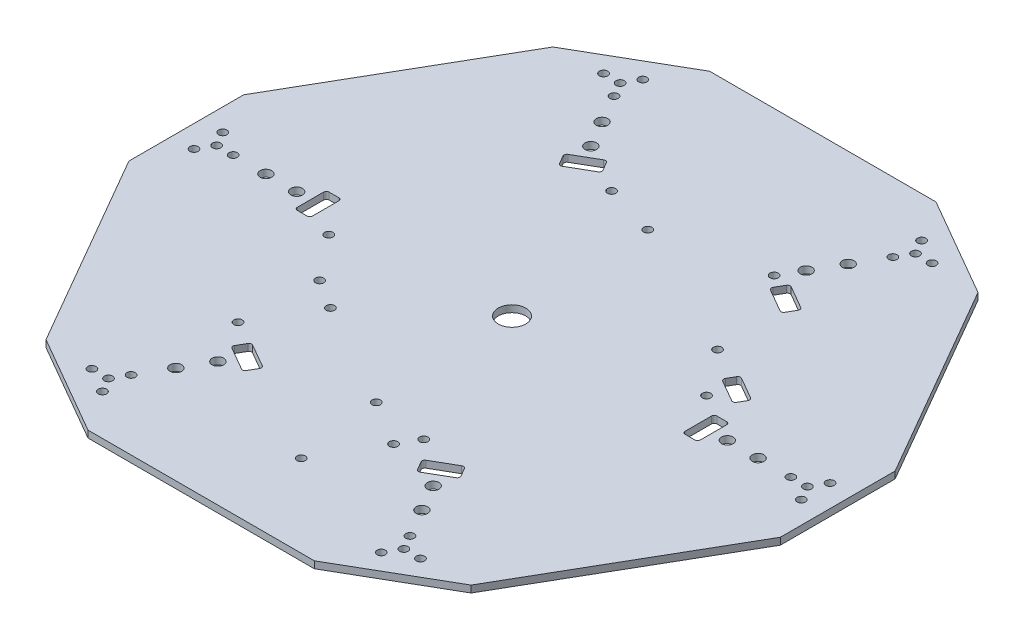
from build123d import *

# Parameters (mm, degrees)
SKETCH_2_R                       = 5
EXTRUDE_1_DEPTH                  = 2.5
EXTRUDE_2_DEPTH                  = 2.5
SKETCH_5_R                       = 2.0999999999999988
SKETCH_5_R_2                     = 2.100000000000004
SKETCH_5_R_3                     = 2.099999999998557
CUT_EXTRUDE_2_DEPTH              = 10
CUT_EXTRUDE_3_DEPTH              = 10
EXTRUDE_3_DEPTH                  = 2.5
SKETCH_11_R                      = 1.4999999999999971
SKETCH_11_R_2                    = 1.5000000000000118
CUT_EXTRUDE_4_DEPTH              = 167.7640548799412
PATTERN_CIRCULAR_1_COUNT         = 6
CUT_EXTRUDE_12_DEPTH             = 2.5
SKETCH_13_R                      = 2.100000000000004
SKETCH_13_R_2                    = 2.0999999999999988
SKETCH_13_R_3                    = 2.100000000000025
SKETCH_13_R_4                    = 2.100000000000012
CUT_EXTRUDE_13_DEPTH             = 10
SKETCH_14_R                      = 1.5
SKETCH_14_R_2                    = 1.5000000000000042
CUT_EXTRUDE_14_DEPTH             = 10
SKETCH_15_R                      = 1.5000000000008096
SKETCH_15_R_2                    = 1.4999999999999967
SKETCH_15_R_3                    = 1.5000000000008304
SKETCH_15_R_4                    = 1.500000000000004
CUT_EXTRUDE_15_DEPTH             = 10
SKETCH_16_R                      = 1.5000000000000346
SKETCH_16_R_2                    = 1.5000000000000009
SKETCH_16_R_3                    = 1.5
SKETCH_16_R_4                    = 1.499999999999769
SKETCH_16_R_5                    = 1.5000000000000042
CUT_EXTRUDE_16_DEPTH             = 10
CUT_EXTRUDE_17_DEPTH             = 10
FILLET_1_R                       = 1
PATTERN_CIRCULAR_2_COUNT         = 6
FILLET_1_OF_PATTERN_CIRCULAR_2_R = 1
CUT_EXTRUDE_18_DEPTH             = 10
FILLET_2_R                       = 1
FILLET_3_R                       = 1


with BuildPart() as part:
    # 草图2 → 凸台-拉伸1 (new body)
    with BuildSketch(Plane(origin=(0, 0, 0), x_dir=(1, 0, 0), z_dir=(0, 1, 0))):
        Polygon((-54.49999999999993, -3.477e-14), (-27.24999999999998, -47.198384506251855), (27.249999999999954, -47.198384506251855), (54.49999999999991, 3.646e-14), (27.24999999999996, 47.19838450625184), (-27.249999999999996, 47.19838450625184), align=None)
        with Locations(Location((0, 0, 0), (0, 0, 270))):
            Circle(SKETCH_2_R, mode=Mode.SUBTRACT)
    extrude(amount=EXTRUDE_1_DEPTH)

    # 草图4 → 凸台-拉伸2 (add)
    with BuildSketch(Plane(origin=(0, 2.5, 0), x_dir=(1, 0, 0), z_dir=(0, 1, 0))):
        Polygon((-100.68802153517004, -1.422e-14), (-50.34401076758503, -87.1983845062519), (50.344010767585004, -87.19838450625191), (100.68802153517004, -4.34e-15), (50.34401076758504, 87.19838450625187), (-50.344010767585004, 87.19838450625188), align=None)
        Polygon((-54.49999999999996, 2.77e-15), (-27.249999999999964, -47.19838450625187), (27.249999999999975, -47.19838450625187), (54.49999999999995, 8.7e-16), (27.249999999999968, 47.19838450625187), (-27.249999999999986, 47.198384506251855), align=None, mode=Mode.SUBTRACT)
    extrude(amount=-EXTRUDE_2_DEPTH)

    # 草图5 → 切除-拉伸2 (cut)
    with BuildSketch(Plane(origin=(0, 2.5, 0), x_dir=(1, 0, 0), z_dir=(0, 1, 0))):
        with Locations(Location((-44.57050807568873, 77.19838450625188, 0), (0, 0, 270))):
            Circle(SKETCH_5_R)
        with Locations(Location((44.57050807568788, 77.19838450625134, 0), (0, 0, 270))):
            Circle(SKETCH_5_R)
        with Locations(Location((89.14101615137568, -5.2e-15, 0), (0, 0, 270))):
            Circle(SKETCH_5_R_2)
        with Locations(Location((44.57050807568874, -77.19838450625191, 0), (0, 0, 270))):
            Circle(SKETCH_5_R_3)
        with Locations(Location((-44.57050807568966, -77.1983845062503, 0), (0, 0, 270))):
            Circle(SKETCH_5_R)
        with Locations(Location((-89.14101615137751, 1.05471e-12, 0), (0, 0, 270))):
            Circle(SKETCH_5_R_2)
    extrude(amount=-CUT_EXTRUDE_2_DEPTH, mode=Mode.SUBTRACT)

    # 草图8 → 切除-拉伸3 (cut)
    with BuildSketch(Plane(origin=(0, 2.5, 0), x_dir=(1, 0, 0), z_dir=(0, 1, 0))):
        with BuildLine():
            ThreePointArc((-53.230762082014685, 82.19838456084334), (-49.57050805994813, 85.85863855318406), (-44.57050810237423, 87.19838450625186))
            Line((-44.57050810237423, 87.19838450625188), (-50.344010767585, 87.19838450625188))
            Line((-50.344010767585004, 87.19838450625188), (-53.23076208201473, 82.19838456084337))
        make_face()
        with BuildLine():
            ThreePointArc((-44.57050810237423, 87.19838450625186), (-41.18741621572633, 86.60873463082513), (-38.20329227394371, 84.90932238267185))
            ThreePointArc((-38.203292273942594, 84.9093223826732), (-39.5269285032999, 86.0349260035967), (-40.81741705098261, 87.1983845062529))
            Line((-40.81741705098293, 87.19838450625188), (-44.57050810237423, 87.19838450625188))
        make_face()
        with BuildLine():
            ThreePointArc((-55.107307625885255, 78.94811233614202), (-54.744967369851246, 77.24878767182129), (-54.43198421760679, 75.53968371877376))
            ThreePointArc((-54.431984217606775, 75.53968371877376), (-54.41165618691728, 78.97371654642413), (-53.230762082014685, 82.19838456084334))
            Line((-53.23076208201473, 82.19838456084337), (-55.107307625885575, 78.94811233614209))
        make_face()
        with BuildLine():
            ThreePointArc((-40.81741705098261, 87.1983845062529), (-39.5269285032999, 86.0349260035967), (-38.203292273942594, 84.9093223826732))
            ThreePointArc((-38.203292273942594, 84.9093223826732), (1.36916320844e-06, 71.17495173569938), (38.20329438544982, 84.9093241262226))
            ThreePointArc((38.20329438544982, 84.9093241262226), (39.52692953336973, 86.03492690557606), (40.81741705098616, 87.19838450625326))
            Line((40.81741705098662, 87.19838450625187), (-40.81741705098293, 87.19838450625188))
        make_face()
        with BuildLine():
            ThreePointArc((60.00000000000159, 131.17495173569938), (-23.989111873314496, 186.17061076011262), (-40.81741705098261, 87.1983845062529))
            Line((-40.81741705098293, 87.19838450625188), (40.81741705098662, 87.19838450625187))
            ThreePointArc((40.81741705098616, 87.19838450625326), (54.99565902441493, 107.1858398623835), (60.00000000000159, 131.17495173569935))
        make_face()
        with BuildLine():
            ThreePointArc((55.107307625886996, 78.9481123361391), (54.74496732632239, 77.24878745211481), (54.4319841433072, 75.53968327702705))
            ThreePointArc((54.4319841433072, 75.53968327702705), (61.639316281817635, 35.58747592748382), (92.63527665435052, 9.369639456102902))
            ThreePointArc((92.63527665435052, 9.369639456102902), (94.27189594304815, 8.786138730067549), (95.92472467686787, 8.25027217010986))
            Line((95.92472467686883, 8.250272170110883), (55.10730762588728, 78.94811233613918))
        make_face()
        with BuildLine():
            ThreePointArc((173.60084054331455, 65.58747586784833), (120.32348975900132, 125.20966961751529), (55.107307625886996, 78.94811233613913))
            Line((55.10730762588728, 78.94811233613918), (95.92472467686883, 8.250272170110883))
            ThreePointArc((95.92472467686787, 8.25027217010986), (149.23392241966366, 17.31446605912187), (173.60084054331455, 65.58747586784831))
        make_face()
        with BuildLine():
            ThreePointArc((95.92472467686599, -8.250272170113114), (94.27189590521412, -8.786138742944736), (92.63527657946159, -9.369639484034138))
            ThreePointArc((92.63527657946159, -9.369639484034138), (61.63931626068051, -35.58747596409508), (54.431984144071656, -75.53968328158336))
            ThreePointArc((54.431984144071656, -75.53968328158336), (54.74496732676963, -77.24878745438222), (55.10730762588548, -78.94811233614169))
            Line((55.10730762588578, -78.94811233614175), (95.92472467686696, -8.250272170114144))
        make_face()
        with BuildLine():
            ThreePointArc((173.6008405433131, -65.58747586785141), (149.233922419662, -17.31446605912484), (95.92472467686599, -8.250272170113114))
            Line((95.92472467686696, -8.250272170114144), (55.10730762588578, -78.94811233614175))
            ThreePointArc((55.10730762588548, -78.94811233614169), (120.3234897589996, -125.20966961751839), (173.6008405433131, -65.58747586785142))
        make_face()
        with BuildLine():
            ThreePointArc((40.81741705098268, -87.19838450625326), (39.52692870848525, -86.03492618326786), (38.20329269454614, -84.90932272998191))
            ThreePointArc((38.20329269454614, -84.90932272998191), (1.8468539614e-07, -71.17495173570006), (-38.20329240972713, -84.90932249479411))
            ThreePointArc((-38.20329240972713, -84.90932249479411), (-39.52692856954143, -86.03492606159949), (-40.81741705098459, -87.19838450625289))
            Line((-40.81741705098492, -87.1983845062519), (40.81741705098311, -87.19838450625191))
        make_face()
        with BuildLine():
            ThreePointArc((59.99999999999884, -131.17495173570006), (54.995659024411985, -107.18583986238377), (40.81741705098268, -87.19838450625326))
            Line((40.81741705098311, -87.19838450625191), (-40.81741705098492, -87.1983845062519))
            ThreePointArc((-40.81741705098459, -87.19838450625289), (-23.9891118733177, -186.1706107601131), (59.99999999999884, -131.1749517357001))
        make_face()
        with BuildLine():
            ThreePointArc((-53.60084054331403, -65.58747586784905), (-64.316290116571, -31.36711512700029), (-92.63527685110812, -9.369639382725772))
            ThreePointArc((-92.63527685110812, -9.369639382725772), (-94.27189604244838, -8.786138696243171), (-95.92472467686852, -8.250272170110236))
            Line((-95.92472467686895, -8.250272170110707), (-55.107307625886826, -78.94811233613997))
            ThreePointArc((-55.10730762588652, -78.94811233613994), (-54.74496731446588, -77.24878739227698), (-54.43198412306994, -75.53968315671419))
            ThreePointArc((-54.43198412306994, -75.53968315671419), (-53.808987481150766, -70.58090228591884), (-53.60084054331403, -65.58747586784907))
        make_face()
        with BuildLine():
            Line((-55.107307625886826, -78.94811233613997), (-95.92472467686895, -8.250272170110707))
            ThreePointArc((-95.92472467686852, -8.250272170110236), (-165.56236477038047, -95.58747586784885), (-55.10730762588652, -78.94811233613994))
        make_face()
        with BuildLine():
            ThreePointArc((-53.600840543312685, 65.58747586785077), (-53.808987504866245, 70.58090256990849), (-54.43198421760679, 75.53968371877376))
            ThreePointArc((-54.43198421760679, 75.53968371877376), (-54.744967369851246, 77.24878767182129), (-55.107307625885255, 78.94811233614202))
            Line((-55.107307625885575, 78.94811233614209), (-95.92472467686801, 8.25027217011231))
            ThreePointArc((-95.92472467686757, 8.250272170111835), (-94.27189606762344, 8.7861386876776), (-92.63527690094196, 9.369639364142245))
            ThreePointArc((-92.63527690094196, 9.369639364142245), (-64.31629013173725, 31.36711510515748), (-53.600840543312685, 65.58747586785076))
        make_face()
        with BuildLine():
            Line((-95.92472467686801, 8.25027217011231), (-55.107307625885575, 78.94811233614209))
            ThreePointArc((-55.107307625885255, 78.94811233614202), (-165.56236477037913, 95.58747586785056), (-95.92472467686757, 8.250272170111835))
        make_face()
        with BuildLine():
            Line((50.34401076758504, 87.19838450625187), (44.570508075686526, 87.19838450625187))
            ThreePointArc((44.570508075686526, 87.19838450625122), (49.570508048389875, 85.85863855985609), (53.23076208201189, 82.198384560846))
            Line((53.2307620820129, 82.19838456084658), (50.34401076758504, 87.19838450625187))
        make_face()
        with BuildLine():
            ThreePointArc((40.81741705098616, 87.19838450625326), (39.52692953336973, 86.03492690557606), (38.20329438544982, 84.9093241262226))
            ThreePointArc((38.20329438544982, 84.9093241262226), (41.18741749159953, 86.60873508951073), (44.570508075686526, 87.19838450625122))
            Line((44.570508075686526, 87.19838450625187), (40.81741705098662, 87.19838450625187))
        make_face()
        with BuildLine():
            ThreePointArc((54.570508075687755, 77.19838450625134), (54.535816918773456, 76.36614676262403), (54.43198414330418, 75.53968327702755))
            ThreePointArc((54.4319841433072, 75.53968327702705), (54.74496732632239, 77.24878745211481), (55.107307625886996, 78.9481123361391))
            Line((55.10730762588728, 78.94811233613918), (53.2307620820129, 82.19838456084658))
            ThreePointArc((53.23076208201189, 82.198384560846), (54.2297663304204, 79.78657498772276), (54.570508075687755, 77.19838450625134))
        make_face()
        with BuildLine():
            ThreePointArc((95.92472467686787, 8.25027217010986), (94.27189594304815, 8.786138730067549), (92.63527665435052, 9.369639456102902))
            ThreePointArc((92.63527665435024, 9.369639456102183), (95.59907265692769, 7.6350184132778764), (97.8012702555464, 4.999999885118923))
            Line((97.80127025554799, 4.9999998851198475), (95.92472467686883, 8.250272170110883))
        make_face()
        with BuildLine():
            Line((100.68802153517004, -4.34e-15), (97.80127025554799, 4.9999998851198475))
            ThreePointArc((97.8012702555464, 4.999999885118923), (98.8002744314327, 2.5881903869586145), (99.14101615137542, -5.2e-15))
            ThreePointArc((99.14101615137542, -7.65e-15), (98.80027443406908, -2.5881903771194787), (97.80127026573263, -4.9999998674758555))
            Line((97.80127026573423, -4.99999986747676), (100.68802153517004, 0))
        make_face()
        with BuildLine():
            ThreePointArc((97.80127026573263, -4.9999998674758555), (95.59907263419227, -7.6350184325085735), (92.63527657946048, -9.36963948403116))
            ThreePointArc((92.63527657946159, -9.369639484034138), (94.27189590521412, -8.786138742944736), (95.92472467686599, -8.250272170113114))
            Line((95.92472467686696, -8.250272170114144), (97.80127026573423, -4.99999986747676))
        make_face()
        with BuildLine():
            ThreePointArc((55.10730762588548, -78.94811233614169), (54.74496732676963, -77.24878745438222), (54.431984144071656, -75.53968328158336))
            ThreePointArc((54.431984144069666, -75.5396832815837), (54.53581691896495, -76.36614676492637), (54.570508075687016, -77.19838450625191))
            ThreePointArc((54.570508075687016, -77.19838450625191), (54.229766296791894, -79.78657511322366), (53.23076195208343, -82.19838478588755))
            Line((53.230761952084926, -82.19838478588841), (55.10730762588578, -78.94811233614175))
        make_face()
        with BuildLine():
            ThreePointArc((44.57050807568716, -87.19838450625019), (41.1874164598204, -86.608734718577), (38.20329269454849, -84.90932272997907))
            ThreePointArc((38.20329269454614, -84.90932272998191), (39.52692870848525, -86.03492618326786), (40.81741705098268, -87.19838450625326))
            Line((40.81741705098311, -87.19838450625191), (44.57050807568716, -87.19838450625191))
        make_face()
        with BuildLine():
            Line((50.344010767585004, -87.19838450625191), (53.230761952084926, -82.19838478588841))
            ThreePointArc((53.23076195208343, -82.19838478588755), (49.570507935868946, -85.8586386248193), (44.57050807568716, -87.19838450625019))
            Line((44.57050807568716, -87.19838450625191), (50.344010767585004, -87.19838450625191))
        make_face()
        with BuildLine():
            ThreePointArc((-53.23076226483592, -82.19838424418697), (-54.411656269967374, -78.97371608605633), (-54.43198412306916, -75.53968315671432))
            ThreePointArc((-54.43198412306994, -75.53968315671419), (-54.74496731446588, -77.24878739227698), (-55.10730762588652, -78.94811233613994))
            Line((-55.107307625886826, -78.94811233613997), (-53.230762264836294, -82.19838424418718))
        make_face()
        with BuildLine():
            ThreePointArc((-44.57050807569039, -87.19838450624991), (-49.57050820672134, -85.85863846844305), (-53.23076226483592, -82.19838424418697))
            Line((-53.230762264836294, -82.19838424418718), (-50.34401076758503, -87.1983845062519))
            Line((-50.34401076758503, -87.1983845062519), (-44.57050807569039, -87.1983845062519))
        make_face()
        with BuildLine():
            ThreePointArc((-40.81741705098459, -87.19838450625289), (-39.52692856954143, -86.03492606159949), (-38.20329240972713, -84.90932249479411))
            ThreePointArc((-38.203292409728874, -84.90932249479202), (-41.18741628602644, -86.60873465609623), (-44.57050807569039, -87.19838450624991))
            Line((-44.57050807569039, -87.1983845062519), (-40.81741705098492, -87.1983845062519))
        make_face()
        with BuildLine():
            ThreePointArc((-97.80127036315847, -4.999999698733056), (-99.14101615137776, 2.4618574902e-06), (-97.80126790130113, 5.000003962795072))
            Line((-97.80126790130112, 5.000003962795063), (-100.68802153517004, -1.421e-14))
            Line((-100.68802153517004, -1.422e-14), (-97.80127036315847, -4.99999969873306))
        make_face()
        with BuildLine():
            ThreePointArc((-97.80126790130113, 5.000003962795072), (-95.59907095992703, 7.635019848683925), (-92.63527690094196, 9.36963936414225))
            ThreePointArc((-92.63527690094196, 9.369639364142245), (-94.27189606762344, 8.7861386876776), (-95.92472467686757, 8.250272170111835))
            Line((-95.92472467686801, 8.25027217011231), (-97.80126790130112, 5.000003962795063))
        make_face()
        with BuildLine():
            ThreePointArc((-95.92472467686852, -8.250272170110236), (-94.27189604244838, -8.786138696243171), (-92.63527685110812, -9.369639382725772))
            ThreePointArc((-92.63527685110783, -9.369639382725), (-95.599072819255, -7.635018275975376), (-97.80127036315847, -4.999999698733056))
            Line((-97.80127036315847, -4.99999969873306), (-95.92472467686895, -8.250272170110707))
        make_face()
    extrude(amount=-CUT_EXTRUDE_3_DEPTH, mode=Mode.SUBTRACT)

    # 草图10 → 凸台-拉伸3 (add)
    with BuildSketch(Plane(origin=(0, 2.5, 0), x_dir=(1, 0, 0), z_dir=(0, 1, 0))):
        Polygon((-71.99999999999999, 100.45894683899485), (-123, 12.124355652982146), (-123, -12.12435565298215), (-72.00000000000003, -100.45894683899492), (-50.99999999999987, -112.58330249197701), (51.00000000000006, -112.58330249197698), (72.00000000000006, -100.45894683899473), (123.00000000000007, -12.124355652982047), (122.99999999999993, 12.124355652982286), (71.99999999999996, 100.458946838995), (50.99999999999987, 112.58330249197711), (-51.00000000000007, 112.58330249197701), align=None)
        with BuildLine():
            ThreePointArc((-54.43198414249213, 75.5396832721946), (-49.570508075688885, 85.8586385440978), (-38.20329263630369, 84.90932268188817))
            ThreePointArc((-38.20329263630369, 84.90932268188817), (7.283e-14, 71.17495173569907), (38.20329263630453, 84.90932268188624))
            ThreePointArc((38.203292636304546, 84.90932268188627), (49.570508075688785, 85.85863854409595), (54.43198414249191, 75.53968327219373))
            ThreePointArc((54.43198414249192, 75.53968327219373), (61.63931631624528, 35.58747586784882), (92.63527677879537, 9.369639409692255))
            ThreePointArc((92.63527677879537, 9.369639409692256), (99.14101615137656, -5.8975e-13), (92.63527677879546, -9.369639409693496))
            ThreePointArc((92.63527677879546, -9.369639409693484), (61.63931631624526, -35.58747586784996), (54.431984142491366, -75.53968327219482))
            ThreePointArc((54.43198414249137, -75.53968327219481), (49.570508075688366, -85.85863854409642), (38.2032926363047, -84.90932268188708))
            ThreePointArc((38.203292636304695, -84.90932268188708), (-1.2257e-13, -71.17495173569802), (-38.20329263630518, -84.90932268188645))
            ThreePointArc((-38.20329263630518, -84.90932268188645), (-49.5705080756899, -85.85863854409526), (-54.43198414249369, -75.5396832721929))
            ThreePointArc((-54.4319841424937, -75.5396832721929), (-61.639316316248035, -35.58747586784894), (-92.6352767787973, -9.369639409692589))
            ThreePointArc((-92.63527677879732, -9.369639409692589), (-99.1410161513783, 1.05294e-12), (-92.63527677879708, 9.369639409694523))
            ThreePointArc((-92.63527677879708, 9.369639409694521), (-61.639316316246884, 35.587475867850344), (-54.43198414249213, 75.5396832721946))
        make_face(mode=Mode.SUBTRACT)
    extrude(amount=-EXTRUDE_3_DEPTH)

    # 草图11 → 切除-拉伸4 (cut, through all)
    with BuildSketch(Plane(origin=(0, 2.5, 0), x_dir=(1, 0, 0), z_dir=(0, 1, 0))):
        with Locations(Location((-107, -1.73e-15, 0), (0, 0, 270))):
            Circle(SKETCH_11_R)
        with Locations(Location((-100.99999999999999, -1.73e-15, 0), (0, 0, 270))):
            Circle(SKETCH_11_R)
        with Locations(Location((-109.99999999999999, -5.196152422706643, 0), (0, 0, 270))):
            Circle(SKETCH_11_R)
        with Locations(Location((-110.00000000000001, 5.196152422706629, 0), (0, 0, 270))):
            Circle(SKETCH_11_R_2)
    cut_extrude_4 = extrude(amount=-CUT_EXTRUDE_4_DEPTH, mode=Mode.SUBTRACT)

    # 阵列(圆周)1: 切除-拉伸4 ×6 about axis
    pattern_circular_1_axis = Axis((3.27e-15, 0, 1.2672e-13), (0, 1, 0))
    for i in range(1, PATTERN_CIRCULAR_1_COUNT):
        add(cut_extrude_4.rotate(pattern_circular_1_axis, i * 360 / PATTERN_CIRCULAR_1_COUNT), mode=Mode.SUBTRACT)

    # 草图12 → 切除-拉伸12 (cut)
    with BuildSketch(Plane(origin=(0, 2.5, 0), x_dir=(1, 0, 0), z_dir=(0, 1, 0))):
        Polygon((-145.89599351696353, 84.23309113070678), (-145.89599351696353, -84.23309113070681), (5.898e-14, -168.46618226141356), (145.89599351696356, -84.2330911307068), (145.89599351696353, 84.23309113070677), (-3.469e-14, 168.46618226141354), align=None)
        Polygon((-118.00000000000001, 68.12733176437585), (-118, -68.12733176437587), (5.69e-15, -136.2546635287517), (118.00000000000003, -68.12733176437582), (118, 68.12733176437587), (-2.774e-14, 136.2546635287517), align=None, mode=Mode.SUBTRACT)
    extrude(amount=-CUT_EXTRUDE_12_DEPTH, mode=Mode.SUBTRACT)

    # 草图13 → 切除-拉伸13 (cut)
    with BuildSketch(Plane(origin=(0, 2.5, 0), x_dir=(1, 0, 0), z_dir=(0, 1, 0))):
        with Locations(Location((-78, -1.932e-13, 0), (0, 0, 270))):
            Circle(SKETCH_13_R)
        with Locations(Location((-39.00000000000017, 67.54998149518612, 0), (0, 0, 270))):
            Circle(SKETCH_13_R_2)
        with Locations(Location((38.99999999999982, 67.54998149518633, 0), (0, 0, 270))):
            Circle(SKETCH_13_R_3)
        with Locations(Location((78, 2.0275e-13, 0), (0, 0, 270))):
            Circle(SKETCH_13_R)
        with Locations(Location((39.0000000000002, -67.5499814951861, 0), (0, 0, 270))):
            Circle(SKETCH_13_R_2)
        with Locations(Location((-38.99999999999985, -67.54998149518632, 0), (0, 0, 270))):
            Circle(SKETCH_13_R_4)
    extrude(amount=-CUT_EXTRUDE_13_DEPTH, mode=Mode.SUBTRACT)

    # 草图14 → 切除-拉伸14 (cut)
    with BuildSketch(Plane(origin=(0, 2.5, 0), x_dir=(1, 0, 0), z_dir=(0, 1, 0))):
        with Locations(Location((-2.4987113059642545, 51.67210506462307, 0), (0, 0, 270))):
            Circle(SKETCH_14_R)
        with Locations(Location((-45.99871130596431, -23.672105064623025, 0), (0, 0, 270))):
            Circle(SKETCH_14_R_2)
        with Locations(Location((2.498711305964248, -51.672105064623054, 0), (0, 0, 270))):
            Circle(SKETCH_14_R)
        with Locations(Location((47.748711305964285, 26.703193977868548, 0), (0, 0, 270))):
            Circle(SKETCH_14_R_2)
    extrude(amount=-CUT_EXTRUDE_14_DEPTH, mode=Mode.SUBTRACT)

    # 草图15 → 切除-拉伸15 (cut)
    with BuildSketch(Plane(origin=(0, 2.5, 0), x_dir=(1, 0, 0), z_dir=(0, 1, 0))):
        with Locations(Location((-21.20319397787026, 57.27499074759372, 0), (0, 0, 270))):
            Circle(SKETCH_15_R)
        with Locations(Location((60.203193977868075, 10.274990747593757, 0), (0, 0, 270))):
            Circle(SKETCH_15_R_2)
        with Locations(Location((22.703193977867652, -54.67691453623889, 0), (0, 0, 270))):
            Circle(SKETCH_15_R_3)
        with Locations(Location((-58.70319397786901, -7.676914536239907, 0), (0, 0, 270))):
            Circle(SKETCH_15_R_4)
    extrude(amount=-CUT_EXTRUDE_15_DEPTH, mode=Mode.SUBTRACT)

    # 草图16 → 切除-拉伸16 (cut)
    with BuildSketch(Plane(origin=(0, 0, 0), x_dir=(-1, 0, 0), z_dir=(0, -1, 0))):
        with Locations(Location((-34.74999999999984, 60.18876556301859, 0), (0, 0, 90))):
            Circle(SKETCH_16_R)
        with Locations(Location((-18.703193977867873, -61.605117766514525, 0), (0, 0, 90))):
            Circle(SKETCH_16_R_2)
        with Locations(Location((-6.453193977867925, -82.82274015923329, 0), (0, 0, 90))):
            Circle(SKETCH_16_R_3)
        with Locations(Location((47.673393758659785, -51.572740159233284, 0), (0, 0, 90))):
            Circle(SKETCH_16_R_4)
        with Locations(Location((35.42339375865961, -30.355117766514642, 0), (0, 0, 90))):
            Circle(SKETCH_16_R_5)
        Polygon((-57.717532533297764, 18.219676115230648), (-67.2438119749266, 12.719676115230675), (-69.74381197492657, 17.04980313415288), (-60.21753253329774, 22.54980313415285), align=None)
    extrude(amount=-CUT_EXTRUDE_16_DEPTH, mode=Mode.SUBTRACT)

    # 草图17 → 切除-拉伸17 (cut)
    with BuildSketch(Plane.XZ):
        Polygon((-41.47964607175924, 60.344854476263734), (-31.520353928239096, 66.0948544762653), (-28.77035392823836, 61.331714755451316), (-38.729646071758495, 55.58171475544975), align=None)
    cut_extrude_17 = extrude(amount=-CUT_EXTRUDE_17_DEPTH, mode=Mode.SUBTRACT)

    # 圆角1
    fillet_1_edges = [part.edges().sort_by_distance(p)[0] for p in [
        (-38.729646071758495, 1.25, 55.58171475544975),
        (-41.47964607175924, 1.25, 60.344854476263734),
        (-31.520353928239096, 1.25, 66.0948544762653),
        (-28.77035392823836, 1.25, 61.331714755451316),
    ]]
    fillet(fillet_1_edges, radius=FILLET_1_R)

    # 阵列(圆周)2: 切除-拉伸17 ×6 about axis, 1 skipped
    pattern_circular_2_axis = Axis((3.46e-15, 0, -2.35e-15), (0, 1, 0))
    add([cut_extrude_17.rotate(pattern_circular_2_axis, i * 360 / PATTERN_CIRCULAR_2_COUNT) for i in range(1, PATTERN_CIRCULAR_2_COUNT) if i not in (3,)], mode=Mode.SUBTRACT)

    # 圆角1 of 阵列(圆周)2
    fillet_1_of_pattern_circular_2_edges = [part.edges().sort_by_distance(p)[0] for p in [
        (28.77035392824061, 1.25, 61.33171475544793),
        (31.520353928239867, 1.25, 66.09485447626278),
        (41.47964607176182, 1.25, 60.34485447626433),
        (38.72964607176256, 1.25, 55.5817147554495),
        (67.49999999999912, 1.25, 5.749999999998184),
        (72.99999999999912, 1.25, 5.749999999999047),
        (73.00000000000092, 1.25, -5.750000000000953),
        (67.50000000000092, 1.25, -5.750000000001806),
        (-28.77035392824058, 1.25, -61.33171475544794),
        (-31.52035392823983, 1.25, -66.09485447626278),
        (-41.47964607176179, 1.25, -60.34485447626435),
        (-38.72964607176253, 1.25, -55.58171475544952),
        (-67.4999999999991, 1.25, -5.749999999998171),
        (-72.99999999999912, 1.25, -5.749999999999031),
        (-73.00000000000091, 1.25, 5.7500000000009726),
        (-67.50000000000092, 1.25, 5.750000000001825),
    ]]
    fillet(fillet_1_of_pattern_circular_2_edges, radius=FILLET_1_OF_PATTERN_CIRCULAR_2_R)

    # 草图18 → 切除-拉伸18 (cut)
    with BuildSketch(Plane.XZ):
        Polygon((37.79246914869614, -55.45847670902142), (40.54246914869613, -60.22161642983584), (50.50176129221719, -54.47161642983586), (47.751761292217196, -49.70847670902144), align=None)
    extrude(amount=-CUT_EXTRUDE_18_DEPTH, mode=Mode.SUBTRACT)

    # 圆角2
    fillet_2_edges = [part.edges().sort_by_distance(p)[0] for p in [
        (37.79246914869614, 1.25, -55.45847670902142),
        (47.751761292217196, 1.25, -49.70847670902144),
        (50.50176129221719, 1.25, -54.47161642983586),
        (40.54246914869613, 1.25, -60.22161642983584),
    ]]
    fillet(fillet_2_edges, radius=FILLET_2_R)

    # 圆角3
    fillet_3_edges = [part.edges().sort_by_distance(p)[0] for p in [
        (60.21753253329774, 1.25, -22.54980313415285),
        (57.717532533297764, 1.25, -18.219676115230648),
        (67.2438119749266, 1.25, -12.719676115230675),
        (69.74381197492657, 1.25, -17.04980313415288),
    ]]
    fillet(fillet_3_edges, radius=FILLET_3_R)


solid = part.part
